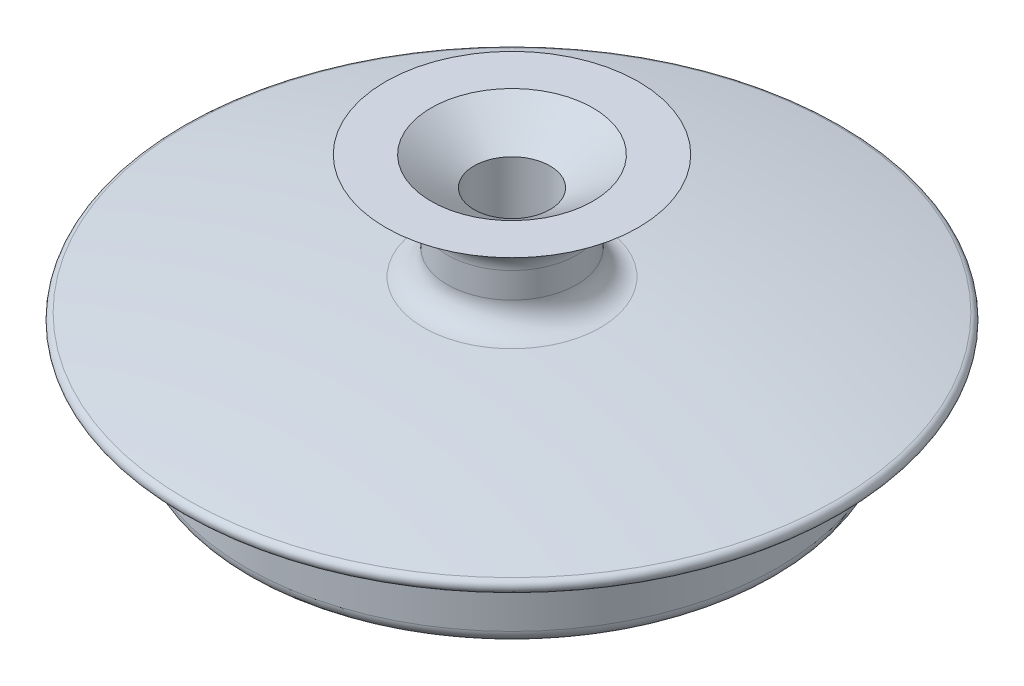
from build123d import *

# Parameters (mm, degrees)
FILLET_1_R = 0.5
FILLET_2_R = 2


with BuildPart() as part:
    # 草图1 → 旋转1 (revolve)
    with BuildSketch(Plane.XY, mode=Mode.PRIVATE) as revolve_1_sk:
        with BuildLine():
            Line((-19, -1.821590968), (-19, -7.821590968))
            ThreePointArc((-19, -7.821590968), (-20, -8.821590968), (-21, -7.821590968))
            Line((-21, -7.821590968), (-21, -1.821590968))
            Line((-21, -1.821590968), (-30, -1.821590968))
            ThreePointArc((-30, -1.821590968), (-17.641064618, 0.580708493), (-5.103162102, 1.727585542))
            Line((-5.103162102, 1.727585542), (-5.103162102, 6.727585542))
            Line((-5.103162102, 6.727585542), (-10, 10))
            Line((-10, 10), (-6.400438845, 10))
            Line((-6.400438845, 10), (-3, 7.727585542))
            Line((-3, 7.727585542), (-3, -0.04501013))
            ThreePointArc((-3, -0.04501013), (-11.035808075, -0.610810748), (-19, -1.821590968))
        make_face()
    revolve(revolve_1_sk.sketch.rotate(Axis((0, -871.515328951, 0), (0, 1, 0)), 180), axis=Axis((0, -871.515328951, 0), (0, 1, 0)))

    # 圆角1
    fillet_1_edges = [part.edges().sort_by_distance(p)[0] for p in [
        (-30, -1.821590968, 0),
    ]]
    fillet(fillet_1_edges, radius=FILLET_1_R)

    # 圆角2
    fillet_2_edges = [part.edges().sort_by_distance(p)[0] for p in [
        (-5.103162102, 1.727585542, 0),
        (-5.103162102, 6.727585542, 0),
    ]]
    fillet(fillet_2_edges, radius=FILLET_2_R)


solid = part.part
